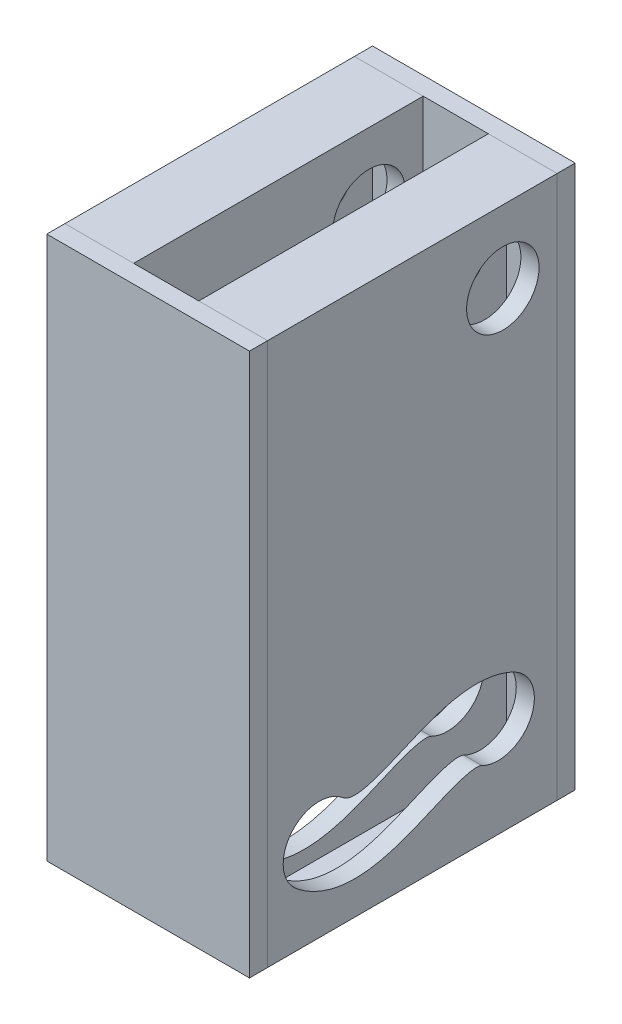
from build123d import *

# Parameters (mm, degrees)
BOSS_EXTRUDE1_DEPTH      = 30
BOSS_EXTRUDE1_DEPTH_BACK = 50
BOSS_EXTRUDE2_START      = 30
SKETCH3_W                = 56
SKETCH3_H                = 150
BOSS_EXTRUDE2_DEPTH      = 5
BOSS_EXTRUDE3_START      = -50
SKETCH3_2_W              = 56
SKETCH3_2_H              = 150
BOSS_EXTRUDE3_DEPTH      = 5
CUT_EXTRUDE1_DEPTH       = 98.128780493
CUT_EXTRUDE1_DEPTH_BACK  = 98.128780493
SKETCH4_R                = 10
SKETCH4_W                = 10
SKETCH4_H                = 10


with BuildPart() as part:
    # Sketch1 → Boss-Extrude1 (new, two sides: drawn at the far end of the back side and taken through both)
    with BuildSketch(Plane.XY.offset(-BOSS_EXTRUDE1_DEPTH_BACK)):
        Polygon((-9, 75), (-9, 35), (9, 35), (9, 75), (28, 75), (28, -75), (9, -75), (9, -35), (-9, -35), (-9, -75), (-28, -75), (-28, 75), align=None)
        Polygon((-23, 70), (-14, 70), (-14, 30), (14, 30), (14, 70), (23, 70), (23, -70), (14, -70), (14, -30), (-14, -30), (-14, -70), (-23, -70), align=None, mode=Mode.SUBTRACT)
    extrude(amount=BOSS_EXTRUDE1_DEPTH + BOSS_EXTRUDE1_DEPTH_BACK)

    # Sketch4 → Cut-Extrude1 (cut, two sides: drawn at the far end of the back side and taken through both)
    # profile 1 of 3: a face of its own
    with BuildSketch(Plane(origin=(0, 0, 0), x_dir=(0, 0, -1), z_dir=(1, 0, 0)).offset(-CUT_EXTRUDE1_DEPTH_BACK)):
        with Locations(Location((35, 55, 0), (0, 0, 270))):
            Circle(SKETCH4_R)
    # profile 2 of 3: a face of its own
    with BuildSketch(Plane(origin=(0, 0, 0), x_dir=(0, 0, -1), z_dir=(1, 0, 0)).offset(-CUT_EXTRUDE1_DEPTH_BACK)):
        with BuildLine():
            add(Edge.make_bspline(
                [(-9.414189539, -44.578736878), (-9.31767513, -44.656489087), (-9.113036629, -44.812778795), (-8.7500887, -45.059772087), (-8.333337808, -45.295680827), (-7.873566531, -45.493396896), (-7.25328137, -45.684945311), (-6.350810785, -45.824915214), (-4.822538338, -45.784124159), (-2.813506908, -45.432908763), (0.41609143, -44.510917833), (5.256943005, -42.577080666), (11.894501963, -39.645710226), (18.098099653, -37.353499684), (23.69682286, -36.164182727), (28.290309699, -35.834902052), (32.428324451, -36.311304854), (35.767718457, -37.297100691), (37.423145308, -38.010327491), (38.21880104, -38.411772903)],
                knots=[0, 0, 0, 0, 0.015625, 0.03125, 0.0625, 0.09375, 0.125, 0.1875, 0.25, 0.3125, 0.375, 0.5, 0.625, 0.75, 0.8125, 0.875, 0.9375, 0.96875, 1, 1, 1, 1], degree=3))
            ThreePointArc((38.21880104, -38.411772903), (42.642196948, -51.844329199), (29.209640652, -56.267725107))
            add(Edge.make_bspline(
                [(-21.961219762, -60.153461036), (-21.232593383, -60.740443964), (-19.704916822, -61.846718785), (-16.504676224, -63.673266596), (-12.272284972, -65.219935197), (-7.224505074, -65.915557119), (-0.896012536, -65.640194006), (6.07563566, -63.822958794), (13.328053038, -60.874420614), (19.68715042, -58.069130828), (24.043903268, -56.528527018), (26.604346728, -56.01543222), (27.954339306, -55.948758135), (28.721905221, -56.063142805), (29.039969472, -56.182118086), (29.209640652, -56.267725107)],
                knots=[0, 0, 0, 0, 0.03125, 0.0625, 0.125, 0.1875, 0.25, 0.375, 0.5, 0.625, 0.75, 0.8125, 0.875, 0.9375, 1, 1, 1, 1], degree=3))
            ThreePointArc((-21.961219762, -60.153461036), (-23.475066729, -46.092583845), (-9.414189539, -44.578736878))
        make_face()
        with Locations((-5.884436211, -55.799662067)):
            Rectangle(SKETCH4_W, SKETCH4_H, mode=Mode.SUBTRACT)
    # profile 3 of 3: a face of its own
    with BuildSketch(Plane(origin=(0, 0, 0), x_dir=(0, 0, -1), z_dir=(1, 0, 0)).offset(-CUT_EXTRUDE1_DEPTH_BACK)):
        with Locations((-5.884436211, -55.799662067)):
            Rectangle(SKETCH4_W, SKETCH4_H)
    extrude(amount=CUT_EXTRUDE1_DEPTH + CUT_EXTRUDE1_DEPTH_BACK, mode=Mode.SUBTRACT)


with BuildPart() as body_2:
    # Sketch3 → Boss-Extrude2 (new body)
    with BuildSketch(Plane.XY.offset(BOSS_EXTRUDE2_START)):
        Rectangle(SKETCH3_W, SKETCH3_H)
    extrude(amount=BOSS_EXTRUDE2_DEPTH)


with BuildPart() as body_3:
    # Sketch3<2> → Boss-Extrude3 (new body)
    with BuildSketch(Plane.XY.offset(BOSS_EXTRUDE3_START)):
        Rectangle(SKETCH3_2_W, SKETCH3_2_H)
    extrude(amount=-BOSS_EXTRUDE3_DEPTH)


solid = Compound([part.part, body_2.part, body_3.part])
